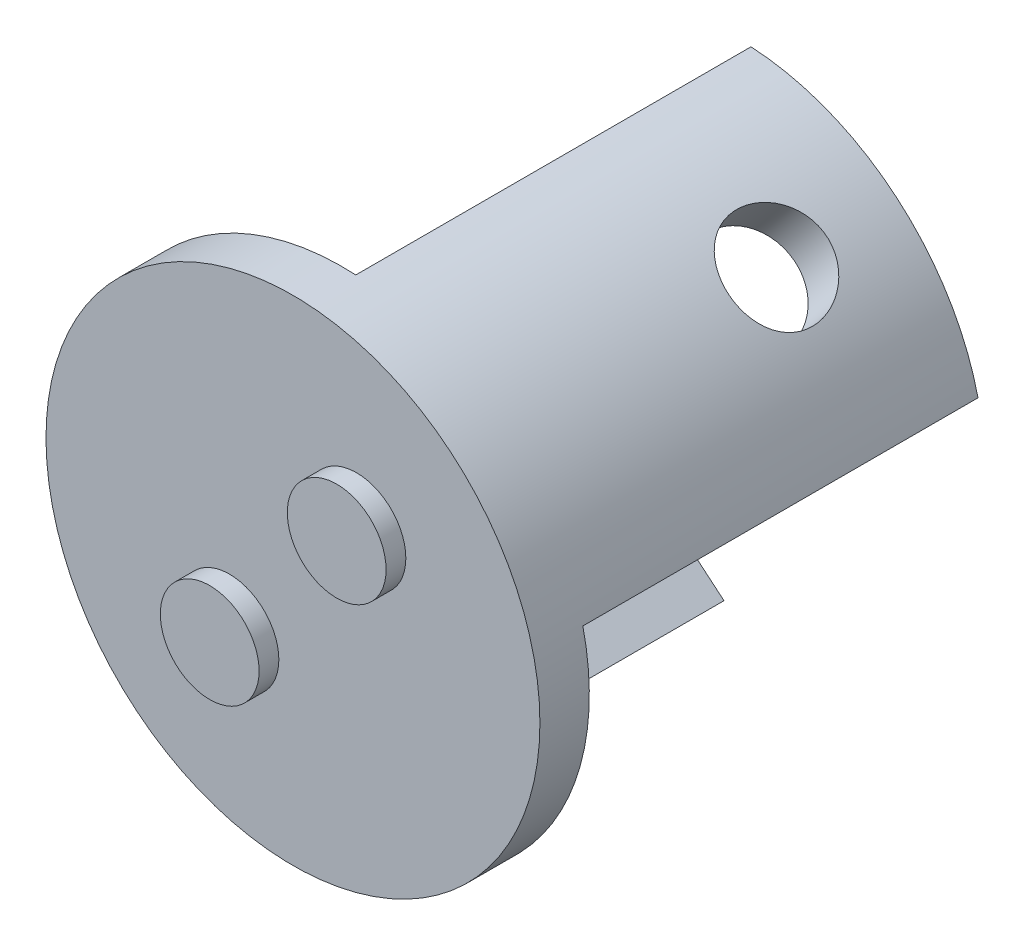
from build123d import *
from build123d.topology import SkipClean

# Parameters (mm, degrees)
SKETCH1_R               = 25
BOSS_EXTRUDE1_DEPTH     = 5
SKETCH2_R               = 5
BOSS_EXTRUDE2_DEPTH     = 2
BOSS_EXTRUDE3_START     = 40
BOSS_EXTRUDE3_DEPTH     = 40
CUT_EXTRUDE1_DEPTH      = 69.255637517
CUT_EXTRUDE1_DEPTH_BACK = 69.255637517
SKETCH6_R               = 5


with BuildPart() as part:
    # Sketch1 → Boss-Extrude1 (new body)
    with BuildSketch(Plane.XY):
        Circle(SKETCH1_R)
    extrude(amount=BOSS_EXTRUDE1_DEPTH)

    # Sketch2 → Boss-Extrude2 (add)
    with BuildSketch(Plane.XY.offset(5)):
        with BuildLine():
            ThreePointArc((-1.427876097, -7.660444431), (-4.71777538, -2.961981327), (-10.258098312, -4.446506383))
            Line((-10.258098312, -4.446506383), (-2.597653881, -10.87438248))
            ThreePointArc((-2.597653881, -10.87438248), (-1.729412993, -9.370545148), (-1.427876097, -7.660444431))
        make_face()
        with BuildLine():
            Line((-2.597653881, -10.87438248), (-10.258098312, -4.446506383))
            ThreePointArc((-10.258098312, -4.446506383), (-9.641814145, -11.490666647), (-2.597653881, -10.87438248))
        make_face()
        with Locations((6.427876097, 7.660444431)):
            Circle(SKETCH2_R)
    extrude(amount=BOSS_EXTRUDE2_DEPTH)

    # Sketch3 → Boss-Extrude3 (add)
    with SkipClean():  # the faces are left unmerged after this step: merging them gives an invalid solid
        with BuildSketch(Plane(origin=(0, 0, 0), x_dir=(-1, 0, 0), z_dir=(0, 0, -1)).offset(BOSS_EXTRUDE3_START)):
            with BuildLine():
                Line((-24.346418841, 5.679074717), (-1.365085547, 24.962703008))
                ThreePointArc((-1.365085547, 24.962703008), (-16.069690242, 19.151111078), (-24.346418841, 5.679074717))
            make_face()
            with BuildLine():
                ThreePointArc((1.365085547, -24.962703008), (16.069690242, -19.151111078), (24.346418841, -5.679074717))
                Line((24.346418841, -5.679074717), (1.365085547, -24.962703008))
            make_face()
        extrude(amount=-BOSS_EXTRUDE3_DEPTH)

    # Sketch6 → Cut-Extrude1 (cut, two sides: drawn at the far end of the back side and taken through both)
    with SkipClean():  # the faces are left unmerged after this step: merging them gives an invalid solid
        with BuildSketch(Plane(origin=(12.855752194, 15.320888862, 0), x_dir=(0.7660444431189768, -0.642787609686541, 0), z_dir=(-0.642787609686541, -0.7660444431189768, 0)).offset(-CUT_EXTRUDE1_DEPTH_BACK)):
            with Locations((0, -28)):
                Circle(SKETCH6_R)
        extrude(amount=CUT_EXTRUDE1_DEPTH + CUT_EXTRUDE1_DEPTH_BACK, mode=Mode.SUBTRACT)


solid = part.part
